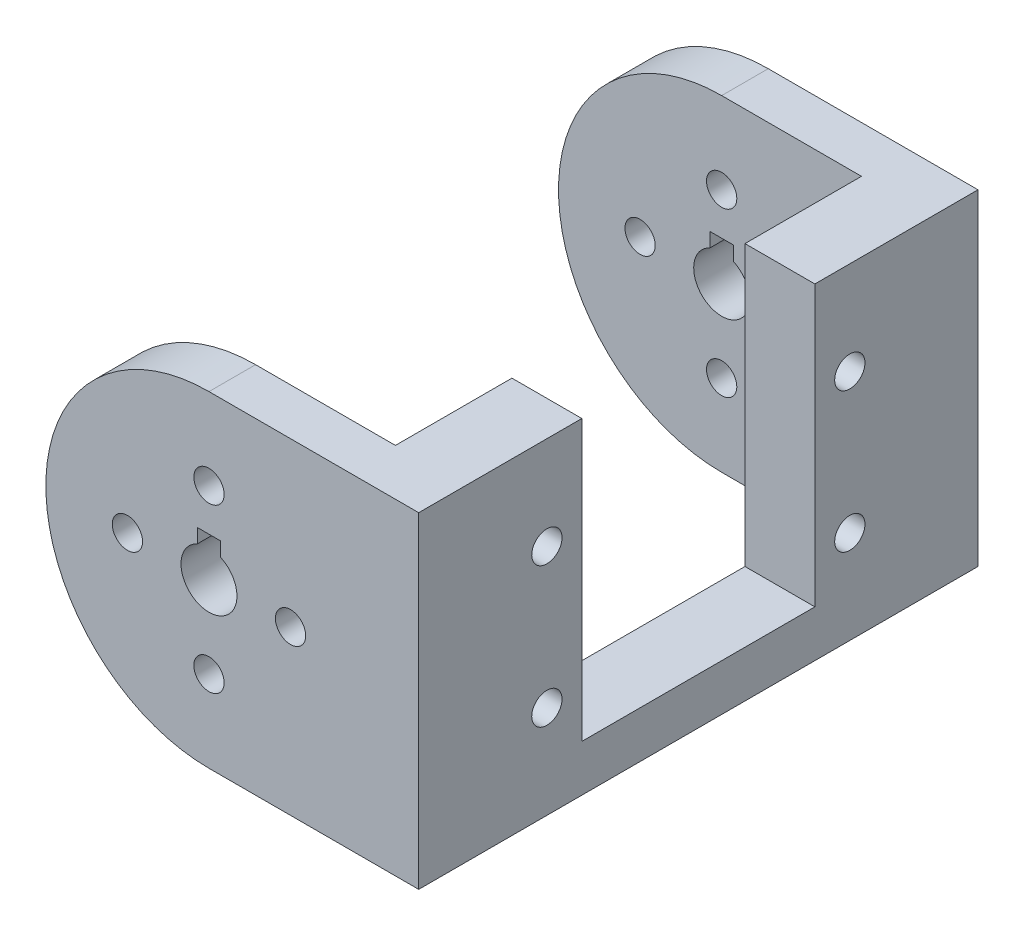
from build123d import *

# Parameters (mm, degrees)
BOSS_EXTRUDE1_DEPTH = 35
FILLET1_RADIUS      = 35
FILLET1_LENGTH      = 10
FILLET2_RADIUS      = 35
FILLET2_LENGTH      = 10
CUT_EXTRUDE1_DEPTH  = 132.244047484
SKETCH4_R           = 3.25
CUT_EXTRUDE2_DEPTH  = 132.244047484
CIRPATTERN1_COUNT   = 4
CUT_EXTRUDE3_DEPTH  = 106.948100502
SKETCH6_R           = 3.25
CUT_EXTRUDE4_DEPTH  = 23


with BuildPart() as part:
    # Sketch1 → Boss-Extrude1 (new, symmetric)
    with BuildSketch(Plane(origin=(0, 0, 0), x_dir=(1, 0, 0), z_dir=(0, 1, 0))):
        Polygon((25, -50), (-40, -50), (-40, -60), (40, -60), (40, 60), (-40, 60), (-40, 50), (25, 50), align=None)
    extrude(amount=BOSS_EXTRUDE1_DEPTH, both=True)

    # Fillet1: full round fillet: the end face becomes a half cylinder, R = half its width
    fillet1_face = Plane((-40, 0, 55), x_dir=(0, 0, 1), z_dir=(-1, 0, 0))  # on the end face: x along it, z out of the body
    fillet1_slab = fillet1_face.offset(-FILLET1_RADIUS / 2) * Box(FILLET1_LENGTH, 2 * FILLET1_RADIUS, FILLET1_RADIUS, mode=Mode.PRIVATE)  # the body's end, R deep
    fillet1_round = Plane((-5, 0, 55), x_dir=(-1, 0, 0), z_dir=(0, 0, 1)) * Cylinder(FILLET1_RADIUS, FILLET1_LENGTH, mode=Mode.PRIVATE)  # its axis R under the face
    add(fillet1_slab - fillet1_round, mode=Mode.SUBTRACT)

    # Fillet2: full round fillet: the end face becomes a half cylinder, R = half its width
    fillet2_face = Plane((-40, 0, -55), x_dir=(0, 0, -1), z_dir=(-1, 0, 0))  # on the end face: x along it, z out of the body
    fillet2_slab = fillet2_face.offset(-FILLET2_RADIUS / 2) * Box(FILLET2_LENGTH, 2 * FILLET2_RADIUS, FILLET2_RADIUS, mode=Mode.PRIVATE)  # the body's end, R deep
    fillet2_round = Plane((-5, 0, -55), x_dir=(-1, 0, 0), z_dir=(0, 0, -1)) * Cylinder(FILLET2_RADIUS, FILLET2_LENGTH, mode=Mode.PRIVATE)  # its axis R under the face
    add(fillet2_slab - fillet2_round, mode=Mode.SUBTRACT)

    # Sketch2 → Cut-Extrude1 (cut, through all)
    with BuildSketch(Plane.XY.offset(60)):
        with BuildLine():
            Line((-2.5, 8.5), (-7.5, 8.5))
            Line((-7.5, 8.5), (-7.5, 5.454356057))
            ThreePointArc((-7.5, 5.454356057), (-5, 6), (-2.5, 5.454356057))
            Line((-2.5, 5.454356057), (-2.5, 8.5))
        make_face()
        with BuildLine():
            ThreePointArc((-2.5, 5.454356057), (-5, 6), (-7.5, 5.454356057))
            Line((-7.5, 5.454356057), (-7.5, 3.5))
            Line((-7.5, 3.5), (-2.5, 3.5))
            Line((-2.5, 3.5), (-2.5, 5.454356057))
        make_face()
        with BuildLine():
            Line((-7.5, 3.5), (-7.5, 5.454356057))
            ThreePointArc((-7.5, 5.454356057), (-8.240370349, -5.049752469), (1, 0))
            ThreePointArc((1, 0), (0.049752469, 3.240370349), (-2.5, 5.454356057))
            Line((-2.5, 5.454356057), (-2.5, 3.5))
            Line((-2.5, 3.5), (-7.5, 3.5))
        make_face()
    extrude(amount=-CUT_EXTRUDE1_DEPTH, mode=Mode.SUBTRACT)

    # Sketch4 → Cut-Extrude2 (cut, through all)
    with BuildSketch(Plane.XY.offset(60)):
        with Locations((-5, 17.5)):
            Circle(SKETCH4_R)
    cut_extrude2 = extrude(amount=-CUT_EXTRUDE2_DEPTH, mode=Mode.SUBTRACT)

    # CirPattern1: Cut-Extrude2 ×4 about axis
    cirpattern1_axis = Axis((-5, 0, 0), (0, 0, 1))
    for i in range(1, CIRPATTERN1_COUNT):
        add(cut_extrude2.rotate(cirpattern1_axis, i * 360 / CIRPATTERN1_COUNT), mode=Mode.SUBTRACT)

    # Sketch5 → Cut-Extrude3 (cut, through all)
    with BuildSketch(Plane(origin=(40, 0, 0), x_dir=(0, 0, -1), z_dir=(1, 0, 0))):
        Polygon((-25, 25), (-25, 35), (25, 35), (25, 25), (25, -25), (-25, -25), align=None)
    extrude(amount=-CUT_EXTRUDE3_DEPTH, mode=Mode.SUBTRACT)

    # Sketch6 → Cut-Extrude4 (cut)
    with BuildSketch(Plane.ZY.offset(-25)):
        with Locations((-32.5, 15)):
            Circle(SKETCH6_R)
        with Locations((-32.5, -15)):
            Circle(SKETCH6_R)
        with Locations((32.5, -15)):
            Circle(SKETCH6_R)
        with Locations((32.5, 15)):
            Circle(SKETCH6_R)
    extrude(amount=-CUT_EXTRUDE4_DEPTH, mode=Mode.SUBTRACT)


solid = part.part
